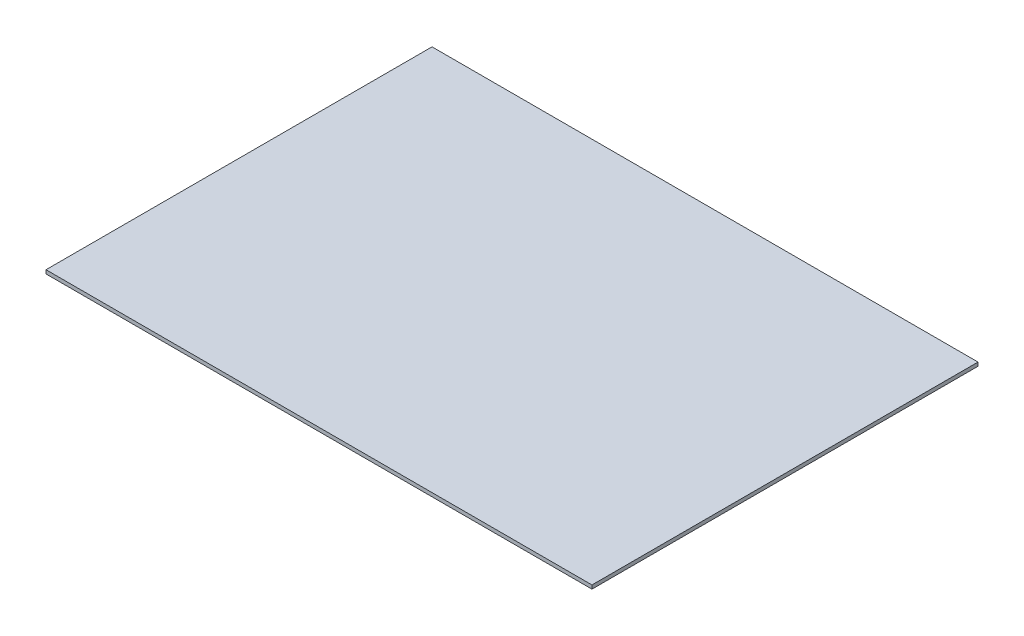
from build123d import *

# Parameters (mm, degrees)
ESQUISSE1_W        = 297
ESQUISSE1_H        = 210
BOSS_EXTRU_1_DEPTH = 2


with BuildPart() as part:
    # Esquisse1 → Boss.-Extru.1 (new body)
    with BuildSketch(Plane(origin=(0, 0, 0), x_dir=(1, 0, 0), z_dir=(0, 1, 0))):
        with Locations((-148.5, 105)):
            Rectangle(ESQUISSE1_W, ESQUISSE1_H)
    extrude(amount=BOSS_EXTRU_1_DEPTH)


solid = part.part
